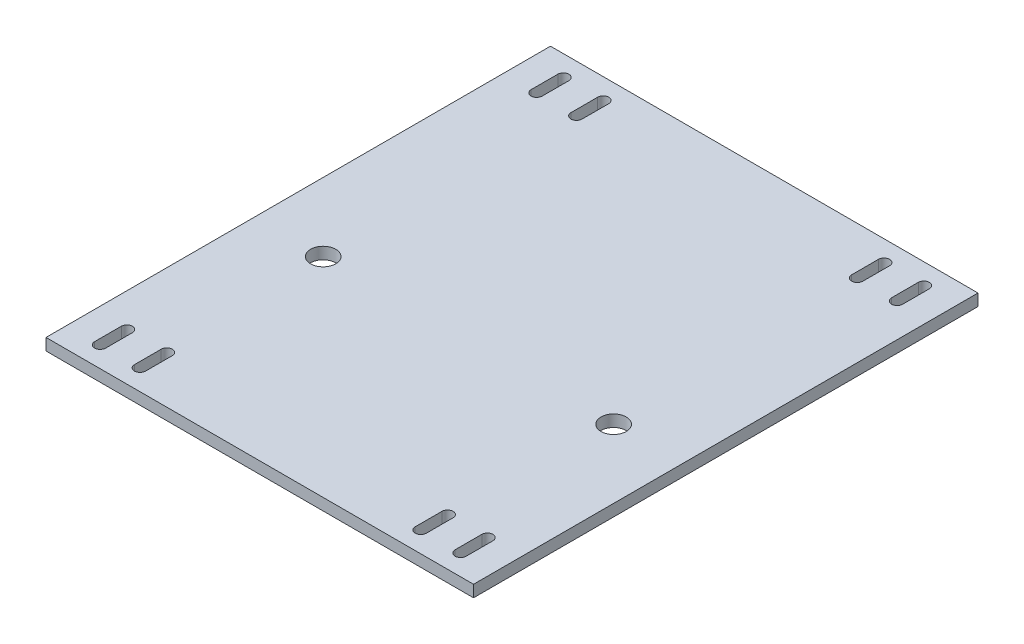
from build123d import *

# Parameters (mm, degrees)
SKETCH1_W                                = 152.4
SKETCH1_H                                = 239.776
BOSS_EXTRUDE1_DEPTH                      = 5.588
CUT_EXTRUDE6_DEPTH                       = 432.430054712
MIRROR1_AT_THE_SECOND_PLANE_COPY_1_DEPTH = 432.430054712
SKETCH8_W                                = 239.776
SKETCH8_H                                = 5.588
BOSS_EXTRUDE2_DEPTH                      = 25.4
CUT_EXTRUDE7_DEPTH                       = 158.247951618
SKETCH10_R                               = 6
CUT_EXTRUDE8_DEPTH                       = 456.882202726


with BuildPart() as part:
    # Sketch1 → Boss-Extrude1 (new body)
    with BuildSketch(Plane(origin=(0, 0, 0), x_dir=(1, 0, 0), z_dir=(0, 1, 0))):
        Rectangle(SKETCH1_W, SKETCH1_H)
    extrude(amount=BOSS_EXTRUDE1_DEPTH)

    # Sketch7 → Cut-Extrude6 (cut, through all)
    with BuildSketch(Plane(origin=(-338.200209725, 5.588, 0), x_dir=(1, 0, 0), z_dir=(0, 1, 0))):
        with BuildLine():
            Line((268.819954903, 97.377738503), (268.819954903, 110.077738503))
            ThreePointArc((268.819954903, 110.077738503), (271.469954903, 112.727738503), (274.119954903, 110.077738503))
            Line((274.119954903, 110.077738503), (274.119954903, 97.377738503))
            ThreePointArc((274.119954903, 97.377738503), (271.469954903, 94.727738503), (268.819954903, 97.377738503))
        make_face()
    cut_extrude6 = extrude(amount=-CUT_EXTRUDE6_DEPTH, mode=Mode.SUBTRACT)

    # Mirror1: Cut-Extrude6 across plane
    add(cut_extrude6.mirror(Plane.XY), mode=Mode.SUBTRACT)

    # Mirror1 at the second plane: Cut-Extrude6 across plane
    add(cut_extrude6.mirror(Plane(origin=(0, 0, 0), x_dir=(0, 0, 1), z_dir=(1, 0, 0))), mode=Mode.SUBTRACT)

    # Mirror1 at the second plane copy 1 sketc → Mirror1 at the second plane copy 1 (cut, through all)
    with BuildSketch(Plane(origin=(338.200209725, 5.588, 0), x_dir=(-1, 0, 0), z_dir=(0, 1, 0))):
        with BuildLine():
            Line((268.819954903, 97.377738503), (268.819954903, 110.077738503))
            ThreePointArc((268.819954903, 110.077738503), (271.469954903, 112.727738503), (274.119954903, 110.077738503))
            Line((274.119954903, 110.077738503), (274.119954903, 97.377738503))
            ThreePointArc((274.119954903, 97.377738503), (271.469954903, 94.727738503), (268.819954903, 97.377738503))
        make_face()
    extrude(amount=-MIRROR1_AT_THE_SECOND_PLANE_COPY_1_DEPTH, mode=Mode.SUBTRACT)

    # Sketch8 → Boss-Extrude2 (add)
    with BuildSketch(Plane.ZY.offset(76.2)):
        with Locations((0, 2.794)):
            Rectangle(SKETCH8_W, SKETCH8_H)
    boss_extrude2 = extrude(amount=BOSS_EXTRUDE2_DEPTH)

    # Sketch9 → Cut-Extrude7 (cut, through all)
    with BuildSketch(Plane(origin=(0, 5.588, 0), x_dir=(1, 0, 0), z_dir=(0, 1, 0))):
        with BuildLine():
            Line((-69.380254823, 110.077738503), (-69.380254823, 97.377738503))
            ThreePointArc((-69.380254823, 97.377738503), (-66.730254823, 94.727738503), (-64.080254823, 97.377738503))
            Line((-64.080254823, 97.377738503), (-64.080254823, 110.077738503))
            ThreePointArc((-64.080254823, 110.077738503), (-66.730254823, 112.727738503), (-69.380254823, 110.077738503))
        make_face()
        with BuildLine():
            Line((-88.319745177, 97.377738503), (-88.319745177, 110.077738503))
            ThreePointArc((-88.319745177, 110.077738503), (-85.669745177, 112.727738503), (-83.019745177, 110.077738503))
            Line((-83.019745177, 110.077738503), (-83.019745177, 97.377738503))
            ThreePointArc((-83.019745177, 97.377738503), (-85.669745177, 94.727738503), (-88.319745177, 97.377738503))
        make_face()
        with BuildLine():
            Line((-88.319745177, -97.377738503), (-88.319745177, -110.077738503))
            ThreePointArc((-88.319745177, -110.077738503), (-85.669745177, -112.727738503), (-83.019745177, -110.077738503))
            Line((-83.019745177, -110.077738503), (-83.019745177, -97.377738503))
            ThreePointArc((-83.019745177, -97.377738503), (-85.669745177, -94.727738503), (-88.319745177, -97.377738503))
        make_face()
    cut_extrude7 = extrude(amount=-CUT_EXTRUDE7_DEPTH, mode=Mode.SUBTRACT)

    # Mirror2: Boss-Extrude2, Cut-Extrude7 across plane
    add(boss_extrude2.mirror(Plane(origin=(0, 0, 0), x_dir=(0, 0, 1), z_dir=(1, 0, 0))))
    add(cut_extrude7.mirror(Plane(origin=(0, 0, 0), x_dir=(0, 0, 1), z_dir=(1, 0, 0))), mode=Mode.SUBTRACT)

    # Sketch10 → Cut-Extrude8 (cut, through all)
    with BuildSketch(Plane(origin=(-338.200209725, 5.588, 0), x_dir=(1, 0, 0), z_dir=(0, 1, 0))):
        with Locations(Location((269.176273717, -20.727348554, 0), (0, 0, 270))):
            Circle(SKETCH10_R)
    cut_extrude8 = extrude(amount=-CUT_EXTRUDE8_DEPTH, mode=Mode.SUBTRACT)

    # Mirror3: Cut-Extrude8 across plane
    add(cut_extrude8.mirror(Plane(origin=(0, 0, 0), x_dir=(0, 0, 1), z_dir=(1, 0, 0))), mode=Mode.SUBTRACT)


solid = part.part
